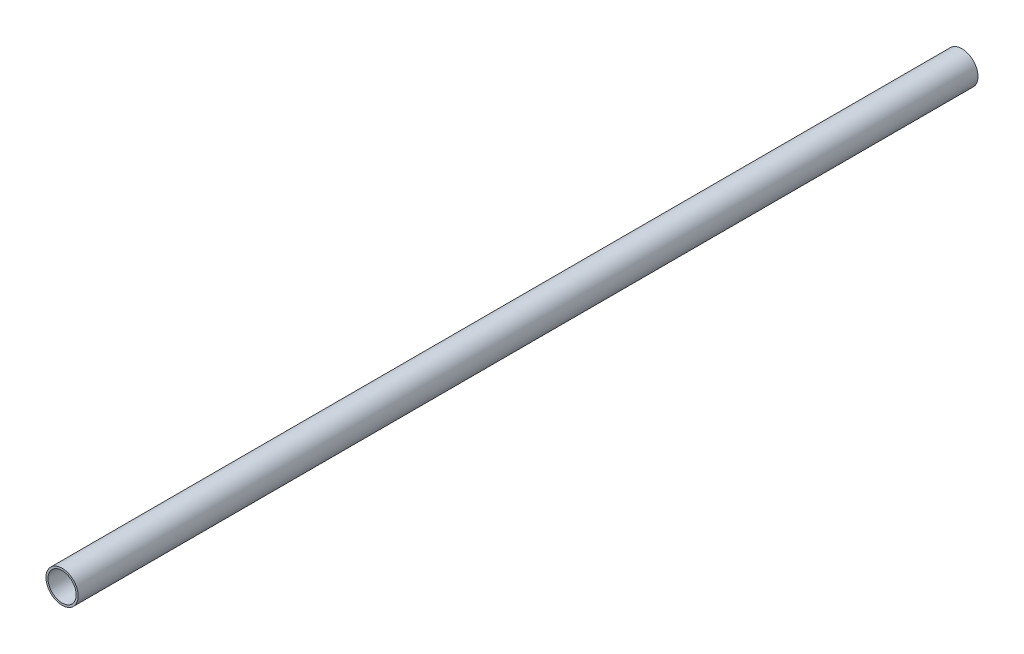
from build123d import *

# Parameters (mm, degrees)
SKETCH1_W    = 450.85
SKETCH1_H    = 1.016
SCALE1_SCALE = 0.6


with BuildPart() as part:
    # Sketch1 → Revolve1 (revolve)
    with BuildSketch(Plane(origin=(0, 0, 0), x_dir=(0, 0, -1), z_dir=(1, 0, 0)), mode=Mode.PRIVATE) as revolve1_sk:
        with Locations((0, 7.5565)):
            Rectangle(SKETCH1_W, SKETCH1_H)
    revolve(revolve1_sk.sketch.rotate(Axis((0, 0, 47.714514654), (0, 0, -1)), 90), axis=Axis((0, 0, 47.714514654), (0, 0, -1)))


with BuildPart() as part_1:
    # Scale1: scaled about (0, 0, 0)
    add(part.part.scale(SCALE1_SCALE))


solid = part_1.part
